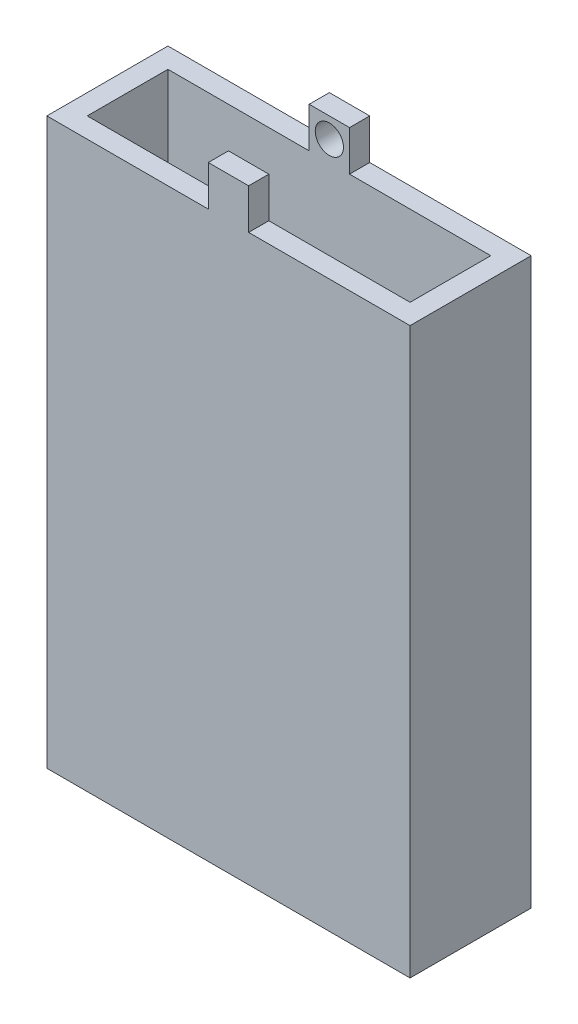
from build123d import *

# Parameters (mm, degrees)
SKETCH1_W           = 90
SKETCH1_H           = 30
BOSS_EXTRUDE1_DEPTH = 140
SKETCH2_W           = 80
SKETCH2_H           = 20
CUT_EXTRUDE1_DEPTH  = 135
SKETCH4_W           = 10
SKETCH4_H           = 30
BOSS_EXTRUDE2_DEPTH = 10
SKETCH7_W           = 20
SKETCH7_H           = 10
CUT_EXTRUDE3_DEPTH  = 10
SKETCH5_R           = 3.5
CUT_EXTRUDE4_DEPTH  = 27.5


with BuildPart() as part:
    # Sketch1 → Boss-Extrude1 (new body)
    with BuildSketch(Plane(origin=(0, 0, 0), x_dir=(1, 0, 0), z_dir=(0, 1, 0))):
        with Locations((-2.788023643, -11.157655047)):
            Rectangle(SKETCH1_W, SKETCH1_H)
    extrude(amount=BOSS_EXTRUDE1_DEPTH)

    # Sketch2 → Cut-Extrude1 (cut)
    with BuildSketch(Plane(origin=(0, 140, 0), x_dir=(1, 0, 0), z_dir=(0, 1, 0))):
        with Locations((-2.788023643, -11.157655047)):
            Rectangle(SKETCH2_W, SKETCH2_H)
    extrude(amount=-CUT_EXTRUDE1_DEPTH, mode=Mode.SUBTRACT)

    # Sketch4 → Boss-Extrude2 (add)
    with BuildSketch(Plane(origin=(0, 140, 0), x_dir=(1, 0, 0), z_dir=(0, 1, 0))):
        with Locations((-2.788023643, -11.157655047)):
            Rectangle(SKETCH4_W, SKETCH4_H)
    extrude(amount=BOSS_EXTRUDE2_DEPTH)

    # Sketch7 → Cut-Extrude3 (cut)
    with BuildSketch(Plane(origin=(2.211976357, 0, 0), x_dir=(0, 0, -1), z_dir=(1, 0, 0))):
        with Locations((-11.157655047, 145)):
            Rectangle(SKETCH7_W, SKETCH7_H)
    extrude(amount=-CUT_EXTRUDE3_DEPTH, mode=Mode.SUBTRACT)

    # Sketch5 → Cut-Extrude4 (cut)
    with BuildSketch(Plane(origin=(0, 0, -3.842344953), x_dir=(-1, 0, 0), z_dir=(0, 0, -1))):
        with Locations((2.788023643, 145)):
            Circle(SKETCH5_R)
    extrude(amount=-CUT_EXTRUDE4_DEPTH, mode=Mode.SUBTRACT)


solid = part.part
